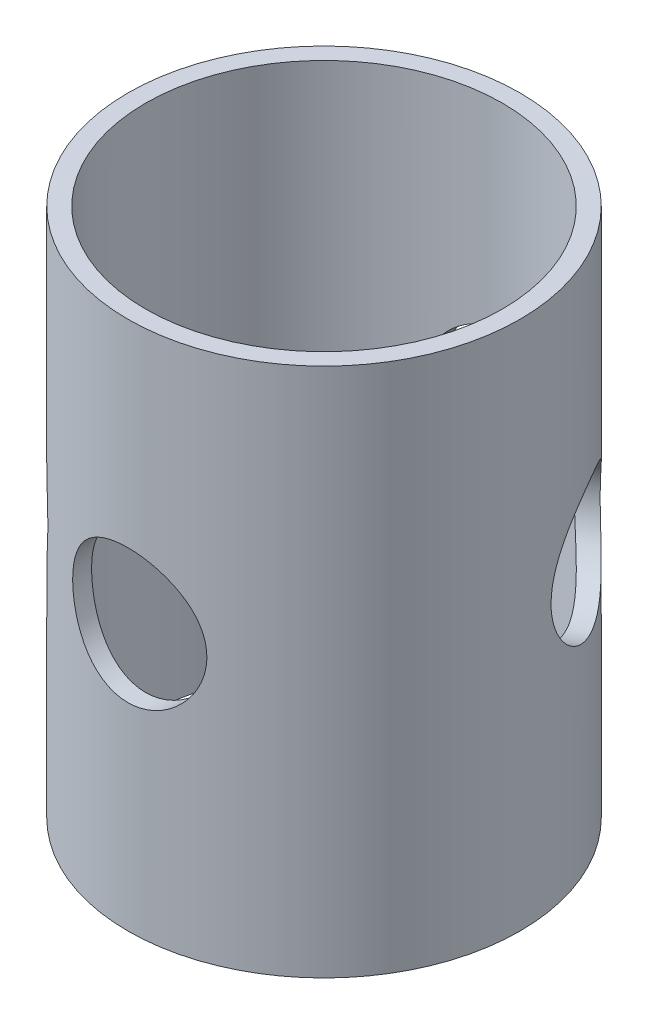
from build123d import *

# Parameters (mm, degrees)
SKETCH2_R           = 28.194
SKETCH2_R_2         = 25.654
BOSS_EXTRUDE1_DEPTH = 76.2
SKETCH3_R           = 9.652
CUT_EXTRUDE1_DEPTH  = 76.2
CIRPATTERN1_COUNT   = 2
CIRPATTERN1_ANGLE   = 60
CIRPATTERN2_COUNT   = 2
CIRPATTERN3_COUNT   = 2
CIRPATTERN3_ANGLE   = 120


with BuildPart() as part:
    # Sketch2 → Boss-Extrude1 (new body)
    with BuildSketch(Plane(origin=(0, 0, 0), x_dir=(1, 0, 0), z_dir=(0, 1, 0))):
        with Locations(Location((0, 0, 0), (0, 0, 90))):
            Circle(SKETCH2_R)
        with Locations(Location((0, 0, 0), (0, 0, 90))):
            Circle(SKETCH2_R_2, mode=Mode.SUBTRACT)
    extrude(amount=BOSS_EXTRUDE1_DEPTH)

    # Sketch3 → Cut-Extrude1 (cut)
    with BuildSketch(Plane.XY):
        with Locations(Location((0, 38.1, 0), (0, 0, 90))):
            Circle(SKETCH3_R)
    cut_extrude1 = extrude(amount=-CUT_EXTRUDE1_DEPTH, mode=Mode.SUBTRACT)

    # CirPattern1: Cut-Extrude1 ×2 about axis
    cirpattern1_axis = Axis((0, 76.2, 0), (0, -1, 0))
    for i in range(1, CIRPATTERN1_COUNT):
        add(cut_extrude1.rotate(cirpattern1_axis, i * CIRPATTERN1_ANGLE / (CIRPATTERN1_COUNT - 1)), mode=Mode.SUBTRACT)

    # CirPattern2: Cut-Extrude1 ×2 about axis
    cirpattern2_axis = Axis((0, 76.2, 0), (0, -1, 0))
    for i in range(1, CIRPATTERN2_COUNT):
        add(cut_extrude1.rotate(cirpattern2_axis, i * 360 / CIRPATTERN2_COUNT), mode=Mode.SUBTRACT)

    # CirPattern3: Cut-Extrude1 ×2 about axis
    cirpattern3_axis = Axis((0, 76.2, 0), (0, 1, 0))
    for i in range(1, CIRPATTERN3_COUNT):
        add(cut_extrude1.rotate(cirpattern3_axis, i * CIRPATTERN3_ANGLE / (CIRPATTERN3_COUNT - 1)), mode=Mode.SUBTRACT)


solid = part.part
